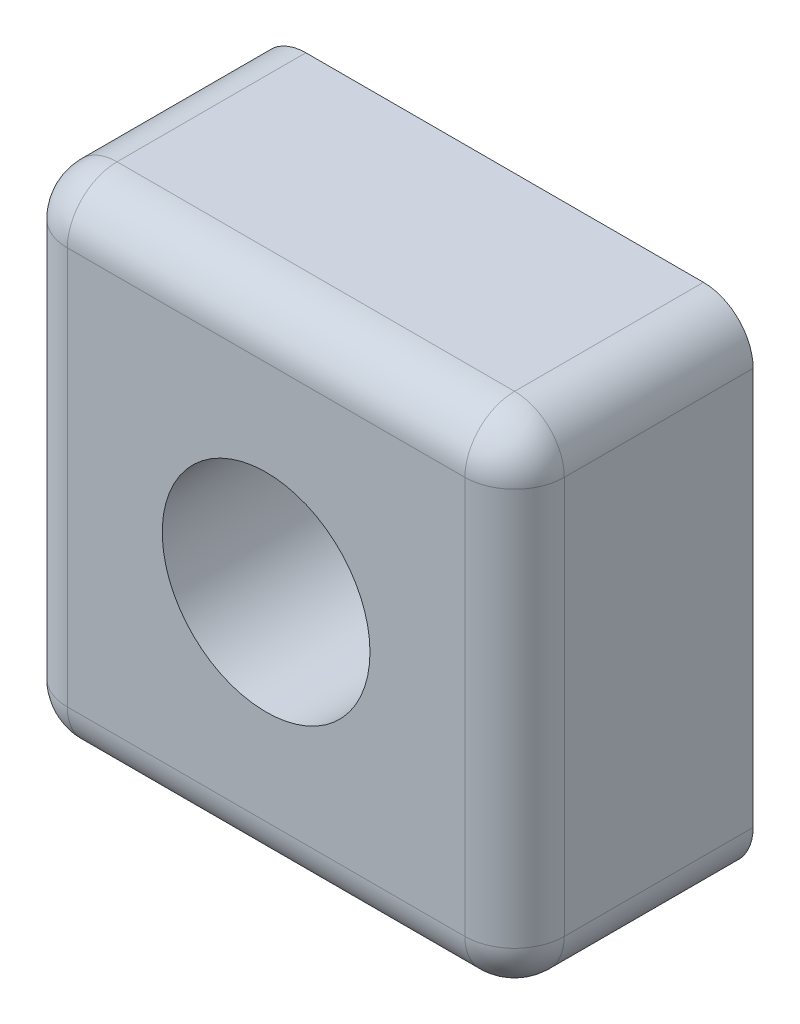
from build123d import *

# Parameters (mm, degrees)
EXTRUDE_1_DEPTH = 48
FILLET_1_R      = 10
FILLET_3_R      = 10


with BuildPart() as part:
    # 草图1 → 凸台-拉伸1 (new body)
    with BuildSketch(Plane.XY):
        with BuildLine():
            Line((0, 20.9), (0, 25))
            Line((0, 25), (0, 48.210201589))
            Line((0, 48.210201589), (0, 50))
            Line((0, 50), (-50, 50))
            Line((-50, 50), (-50, 0))
            Line((-50, 0), (-20.9, 0))
            ThreePointArc((-20.9, 0), (-14.778531727, 14.778531727), (0, 20.9))
        make_face()
        with BuildLine():
            Line((50, 0), (20.9, 0))
            ThreePointArc((20.9, 0), (14.778531727, -14.778531727), (0, -20.9))
            Line((0, -20.9), (0, -25))
            Line((0, -25), (50, -25))
            Line((50, -25), (50, 0))
        make_face()
        with BuildLine():
            Line((50, 25), (0, 25))
            Line((0, 25), (0, 20.9))
            ThreePointArc((0, 20.9), (14.778531727, 14.778531727), (20.9, 0))
            Line((20.9, 0), (50, 0))
            Line((50, 0), (50, 25))
        make_face()
        Polygon((0, 48.210201589), (0, 25), (50, 25), (50, 50), (0, 50), align=None)
        with BuildLine():
            ThreePointArc((0, -20.9), (-14.778531727, -14.778531727), (-20.9, 0))
            Line((-20.9, 0), (-50, 0))
            Line((-50, 0), (-50, -50))
            Line((-50, -50), (50, -50))
            Line((50, -50), (50, -25))
            Line((50, -25), (0, -25))
            Line((0, -25), (0, -20.9))
        make_face()
    extrude(amount=EXTRUDE_1_DEPTH)

    # 圆角1
    fillet_1_edges = [part.edges().sort_by_distance(p)[0] for p in [
        (-50, -50, 24),
        (-50, 50, 24),
        (50, 50, 24),
        (50, -50, 24),
    ]]
    fillet(fillet_1_edges, radius=FILLET_1_R)

    # 圆角3
    fillet_3_edges = [part.edges().sort_by_distance(p)[0] for p in [
        (0, 50, 48),
        (50, 0, 48),
        (0, -50, 48),
        (-50, 0, 48),
        (-47.071067812, 47.071067812, 48),
        (-47.071067812, -47.071067812, 48),
        (47.071067812, -47.071067812, 48),
        (47.071067812, 47.071067812, 48),
    ]]
    fillet(fillet_3_edges, radius=FILLET_3_R)


solid = part.part
